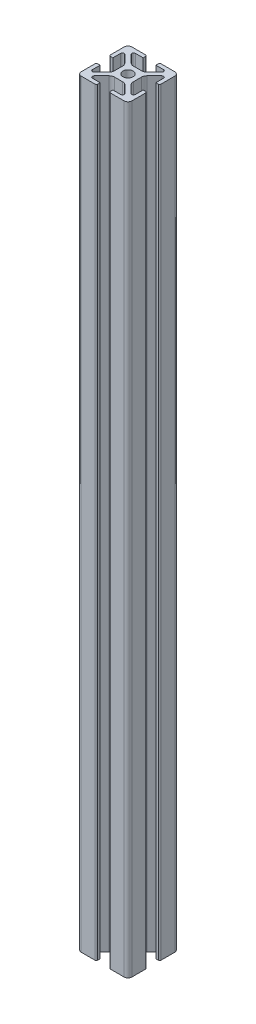
from build123d import *

# Parameters (mm, degrees)
ESQUISSE1_R        = 2
BOSS_EXTRU_1_DEPTH = 300


with BuildPart() as part:
    # Esquisse1 → Boss.-Extru.1 (new body)
    with BuildSketch(Plane(origin=(0, 0, 0), x_dir=(1, 0, 0), z_dir=(0, 1, 0))):
        with BuildLine():
            Line((-5.649708969, 9.692729836), (-5.649708969, 4.192729836))
            ThreePointArc((-5.649708969, 4.192729836), (-5.503262359, 3.839176445), (-5.149708969, 3.692729836))
            Line((-5.149708969, 3.692729836), (-4.149708969, 3.692729836))
            Line((-4.149708969, 3.692729836), (-4.149708969, 6.752780342))
            ThreePointArc((-4.149708969, 6.752780342), (-3.717587371, 7.399496015), (-2.954734222, 7.247755089))
            Line((-2.954734222, 7.247755089), (0.014504594, 4.278516274))
            ThreePointArc((0.014504594, 4.278516274), (0.448050096, 3.629669576), (0.600291031, 2.864302711))
            Line((0.600291031, 2.864302711), (0.600291031, -0.478843039))
            ThreePointArc((0.600291031, -0.478843039), (0.448050096, -1.244209904), (0.014504594, -1.893056602))
            Line((0.014504594, -1.893056602), (-2.954734222, -4.862295417))
            ThreePointArc((-2.954734222, -4.862295417), (-3.717587371, -5.014036343), (-4.149708969, -4.36732067))
            Line((-4.149708969, -4.36732067), (-4.149708969, -1.307270164))
            Line((-4.149708969, -1.307270164), (-5.149708969, -1.307270164))
            ThreePointArc((-5.149708969, -1.307270164), (-5.503262359, -1.453716774), (-5.649708969, -1.807270164))
            Line((-5.649708969, -1.807270164), (-5.649708969, -7.307270164))
            ThreePointArc((-5.649708969, -7.307270164), (-5.21036914, -8.367930336), (-4.149708969, -8.807270164))
            Line((-4.149708969, -8.807270164), (1.350291031, -8.807270164))
            ThreePointArc((1.350291031, -8.807270164), (1.703844422, -8.660823555), (1.850291031, -8.307270164))
            Line((1.850291031, -8.307270164), (1.850291031, -7.307270164))
            Line((1.850291031, -7.307270164), (-1.209759475, -7.307270164))
            ThreePointArc((-1.209759475, -7.307270164), (-1.856475148, -6.875148567), (-1.704734222, -6.112295417))
            Line((-1.704734222, -6.112295417), (1.264504594, -3.143056602))
            ThreePointArc((1.264504594, -3.143056602), (1.913351291, -2.709511099), (2.678718156, -2.557270164))
            Line((2.678718156, -2.557270164), (6.021863907, -2.557270164))
            ThreePointArc((6.021863907, -2.557270164), (6.787230771, -2.709511099), (7.436077469, -3.143056602))
            Line((7.436077469, -3.143056602), (10.405316285, -6.112295417))
            ThreePointArc((10.405316285, -6.112295417), (10.557057211, -6.875148567), (9.910341538, -7.307270164))
            Line((9.910341538, -7.307270164), (6.850291031, -7.307270164))
            Line((6.850291031, -7.307270164), (6.850291031, -8.307270164))
            ThreePointArc((6.850291031, -8.307270164), (6.996737641, -8.660823555), (7.350291031, -8.807270164))
            Line((7.350291031, -8.807270164), (12.850291031, -8.807270164))
            ThreePointArc((12.850291031, -8.807270164), (13.910951203, -8.367930336), (14.350291031, -7.307270164))
            Line((14.350291031, -7.307270164), (14.350291031, -1.807270164))
            ThreePointArc((14.350291031, -1.807270164), (14.203844422, -1.453716774), (13.850291031, -1.307270164))
            Line((13.850291031, -1.307270164), (12.850291031, -1.307270164))
            Line((12.850291031, -1.307270164), (12.850291031, -4.36732067))
            ThreePointArc((12.850291031, -4.36732067), (12.418169434, -5.014036343), (11.655316285, -4.862295417))
            Line((11.655316285, -4.862295417), (8.686077469, -1.893056602))
            ThreePointArc((8.686077469, -1.893056602), (8.252531966, -1.244209904), (8.100291031, -0.478843039))
            Line((8.100291031, -0.478843039), (8.100291031, 2.864302711))
            ThreePointArc((8.100291031, 2.864302711), (8.252531966, 3.629669576), (8.686077469, 4.278516274))
            Line((8.686077469, 4.278516274), (11.655316285, 7.247755089))
            ThreePointArc((11.655316285, 7.247755089), (12.418169434, 7.399496015), (12.850291031, 6.752780342))
            Line((12.850291031, 6.752780342), (12.850291031, 3.692729836))
            Line((12.850291031, 3.692729836), (13.850291031, 3.692729836))
            ThreePointArc((13.850291031, 3.692729836), (14.203844422, 3.839176445), (14.350291031, 4.192729836))
            Line((14.350291031, 4.192729836), (14.350291031, 9.692729836))
            ThreePointArc((14.350291031, 9.692729836), (13.910951203, 10.753390008), (12.850291031, 11.192729836))
            Line((12.850291031, 11.192729836), (7.350291031, 11.192729836))
            ThreePointArc((7.350291031, 11.192729836), (6.996737641, 11.046283226), (6.850291031, 10.692729836))
            Line((6.850291031, 10.692729836), (6.850291031, 9.692729836))
            Line((6.850291031, 9.692729836), (9.910341538, 9.692729836))
            ThreePointArc((9.910341538, 9.692729836), (10.557057211, 9.260608239), (10.405316285, 8.497755089))
            Line((10.405316285, 8.497755089), (7.436077469, 5.528516274))
            ThreePointArc((7.436077469, 5.528516274), (6.787230771, 5.094970771), (6.021863907, 4.942729836))
            Line((6.021863907, 4.942729836), (2.678718156, 4.942729836))
            ThreePointArc((2.678718156, 4.942729836), (1.913351291, 5.094970771), (1.264504594, 5.528516274))
            Line((1.264504594, 5.528516274), (-1.704734222, 8.497755089))
            ThreePointArc((-1.704734222, 8.497755089), (-1.856475148, 9.260608239), (-1.209759475, 9.692729836))
            Line((-1.209759475, 9.692729836), (1.850291031, 9.692729836))
            Line((1.850291031, 9.692729836), (1.850291031, 10.692729836))
            ThreePointArc((1.850291031, 10.692729836), (1.703844422, 11.046283226), (1.350291031, 11.192729836))
            Line((1.350291031, 11.192729836), (-4.149708969, 11.192729836))
            ThreePointArc((-4.149708969, 11.192729836), (-5.21036914, 10.753390008), (-5.649708969, 9.692729836))
        make_face()
        with Locations(Location((4.350291031, 1.192729836, 0), (0, 0, 270))):
            Circle(ESQUISSE1_R, mode=Mode.SUBTRACT)
    extrude(amount=BOSS_EXTRU_1_DEPTH)


solid = part.part
